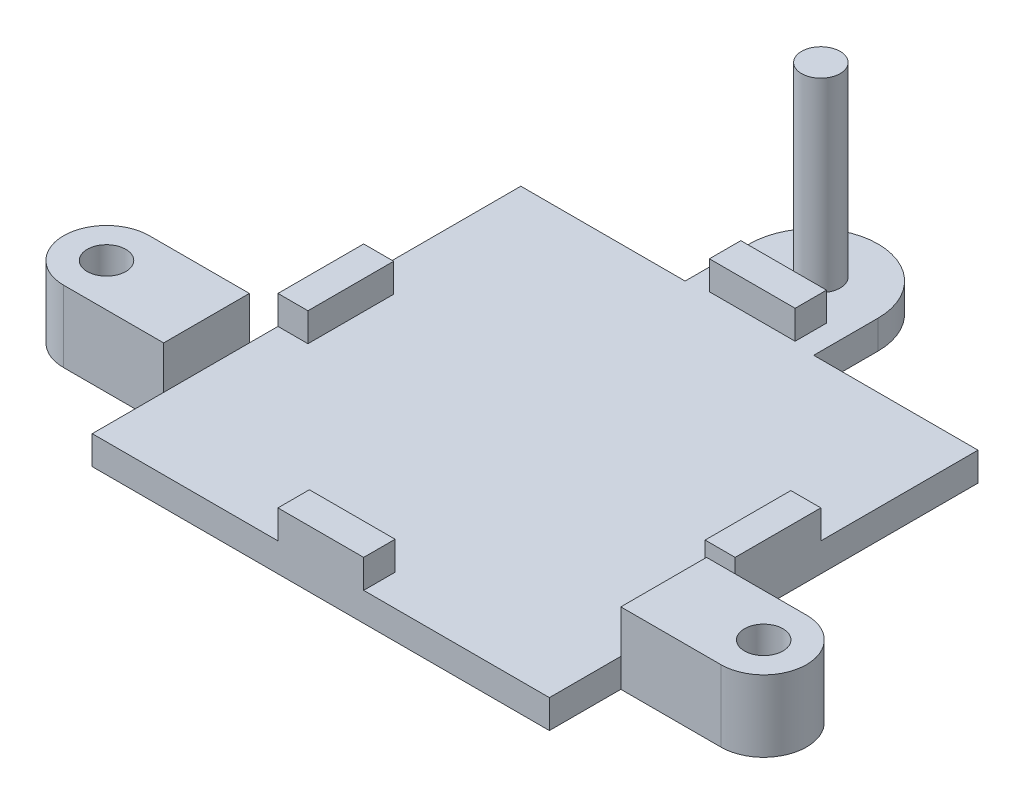
from build123d import *

# Parameters (mm, degrees)
SKETCH1_R           = 1.35
BOSS_EXTRUDE2_DEPTH = 2
SKETCH3_R           = 1.35
BOSS_EXTRUDE3_DEPTH = 13
SKETCH5_R           = 1.35
BOSS_EXTRUDE4_DEPTH = 3
SKETCH6_W           = 6
SKETCH6_H           = 2.2
SKETCH6_W_2         = 2.1
SKETCH6_H_2         = 6
BOSS_EXTRUDE5_DEPTH = 4


with BuildPart() as part:
    # Sketch1 → Boss-Extrude2 (new body)
    with BuildSketch(Plane(origin=(0, 0, 0), x_dir=(1, 0, 0), z_dir=(0, 1, 0))):
        with BuildLine():
            Line((-15.5, 30), (-15.5, 11))
            Line((-15.5, 11), (-22.5, 11))
            ThreePointArc((-22.5, 11), (-25.5, 8), (-22.5, 5))
            Line((-22.5, 5), (-15.5, 5))
            Line((-15.5, 5), (-15.5, 0))
            Line((-15.5, 0), (16.5, 0))
            Line((16.5, 0), (16.5, 5))
            Line((16.5, 5), (23.5, 5))
            ThreePointArc((23.5, 5), (26.5, 8), (23.5, 11))
            Line((23.5, 11), (16.5, 11))
            Line((16.5, 11), (16.5, 30))
            Line((16.5, 30), (5, 30))
            Line((5, 30), (5, 34.5))
            ThreePointArc((5, 34.5), (0.5, 39), (-4, 34.5))
            Line((-4, 34.5), (-4, 30))
            Line((-4, 30), (-15.5, 30))
        make_face()
        with Locations(Location((-22.5, 8, 0), (0, 0, 270))):
            Circle(SKETCH1_R, mode=Mode.SUBTRACT)
        with Locations(Location((23.5, 8, 0), (0, 0, 270))):
            Circle(SKETCH1_R, mode=Mode.SUBTRACT)
    extrude(amount=BOSS_EXTRUDE2_DEPTH)

    # Sketch3 → Boss-Extrude3 (add)
    with BuildSketch(Plane(origin=(0, 2, 0), x_dir=(1, 0, 0), z_dir=(0, 1, 0))):
        with Locations(Location((0.5, 35, 0), (0, 0, 90))):
            Circle(SKETCH3_R)
    extrude(amount=BOSS_EXTRUDE3_DEPTH)

    # Sketch5 → Boss-Extrude4 (add)
    # profile 1 of 2: a face of its own
    with BuildSketch(Plane(origin=(0, 2, 0), x_dir=(1, 0, 0), z_dir=(0, 1, 0))):
        with BuildLine():
            Line((-15.5, 11), (-15.5, 5))
            Line((-15.5, 5), (-22.5, 5))
            ThreePointArc((-22.5, 5), (-25.5, 8), (-22.5, 11))
            Line((-22.5, 11), (-15.5, 11))
        make_face()
        with Locations(Location((-22.5, 8, 0), (0, 0, 270))):
            Circle(SKETCH5_R, mode=Mode.SUBTRACT)
    # profile 2 of 2: a face of its own
    with BuildSketch(Plane(origin=(0, 2, 0), x_dir=(1, 0, 0), z_dir=(0, 1, 0))):
        with BuildLine():
            Line((16.5, 11), (16.5, 5))
            Line((16.5, 5), (23.5, 5))
            ThreePointArc((23.5, 5), (26.5, 8), (23.5, 11))
            Line((23.5, 11), (16.5, 11))
        make_face()
        with Locations(Location((23.5, 8, 0), (0, 0, 270))):
            Circle(SKETCH5_R, mode=Mode.SUBTRACT)
    extrude(amount=BOSS_EXTRUDE4_DEPTH)

    # Sketch6 → Boss-Extrude5 (add)
    with BuildSketch(Plane(origin=(0, 0, 0), x_dir=(1, 0, 0), z_dir=(0, 1, 0))):
        with Locations((0.5, 1.1)):
            Rectangle(SKETCH6_W, SKETCH6_H)
        with Locations((-14.45, 16)):
            Rectangle(SKETCH6_W_2, SKETCH6_H_2)
        with Locations((15.45, 16)):
            Rectangle(SKETCH6_W_2, SKETCH6_H_2)
        with Locations((0.5, 31.3)):
            Rectangle(SKETCH6_W, SKETCH6_H)
    extrude(amount=BOSS_EXTRUDE5_DEPTH)


solid = part.part
